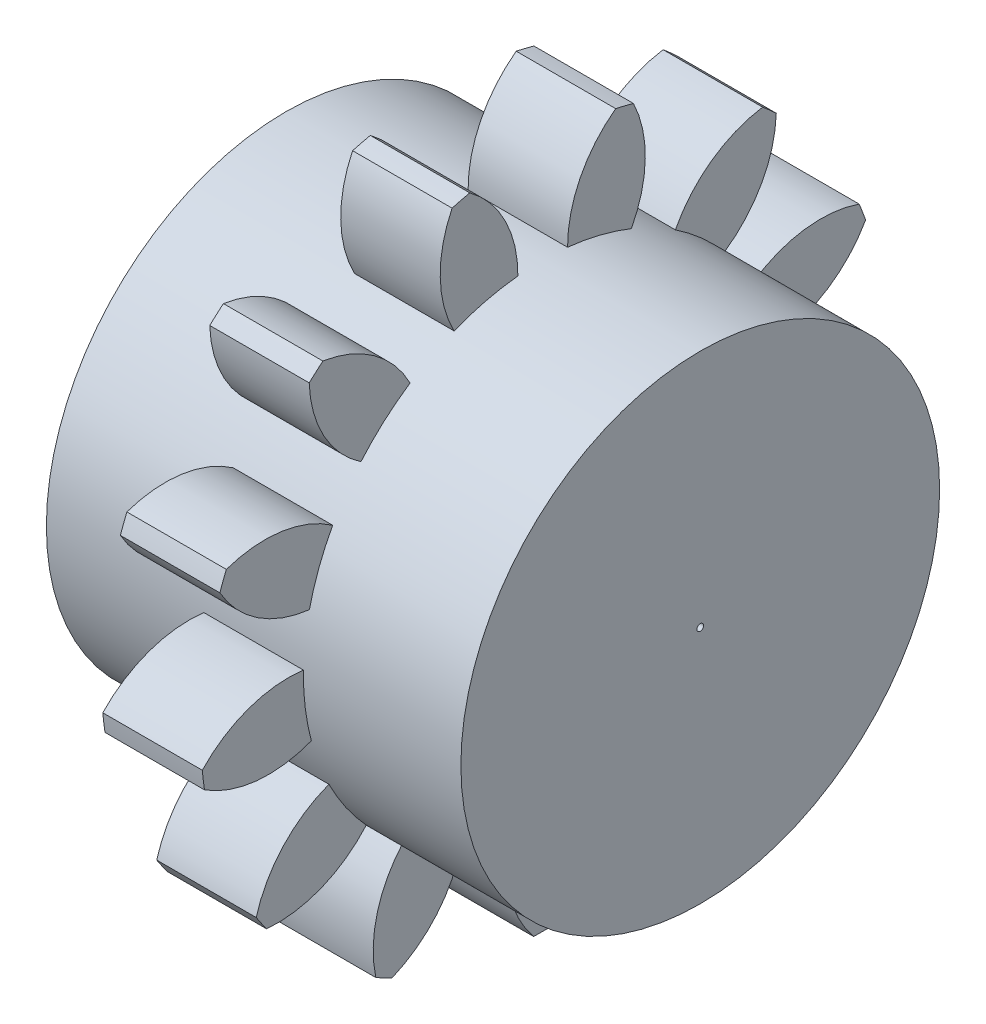
from build123d import *
from build123d.topology import SkipClean

# Parameters (mm, degrees)
BASPROSKE_W       = 12
BASPROSKE_H       = 41.25
TOOTHCUT_DEPTH    = 60.557745088
TEETHCUTS_COUNT   = 13
TEETHCUTS_ANGLE   = 332.307692308
HUBNEARBOTH_START = 19.0000254
HUBNEABOTSKE_R    = 28.874
HUBNEARBOTH_DEPTH = 19.0000254
HUBFARSKE_R       = 28.874
HUBFAR_DEPTH      = 19.0000254
BORSKE_R          = 0.4
BORE_DEPTH        = 50.0000508


with BuildPart() as part:
    # BasProSke → Base-Revolve (revolve)
    with BuildSketch(Plane(origin=(0, 0, 0), x_dir=(1, 0, 0), z_dir=(0, 1, 0)), mode=Mode.PRIVATE) as base_revolve_sk:
        with Locations((6, 20.625)):
            Rectangle(BASPROSKE_W, BASPROSKE_H)
    revolve(base_revolve_sk.sketch.rotate(Axis((-10, 0, 0), (1, 0, 0)), 180), axis=Axis((-10, 0, 0), (1, 0, 0)))

    # TooCutSke → ToothCut (cut, through all)
    with BuildSketch(Plane(origin=(0, 0, 0), x_dir=(0, 0, -1), z_dir=(1, 0, 0))):
        with BuildLine():
            ThreePointArc((2.996554373, 28.718087295), (0, 28.874), (-2.996554373, 28.718087295))
            ThreePointArc((-2.996554373, 28.718087295), (-4.518463565, 35.219204881), (-8.8260662, 40.320704366))
            ThreePointArc((-8.8260662, 40.320704366), (0, 41.2754), (8.8260662, 40.320704366))
            ThreePointArc((8.8260662, 40.320704366), (4.518463565, 35.219204881), (2.996554373, 28.718087295))
        make_face()
    toothcut = extrude(amount=TOOTHCUT_DEPTH, mode=Mode.SUBTRACT)

    # TeethCuts: ToothCut ×13 about axis
    teethcuts_axis = Axis((-10, 0, 0), (1, 0, 0))
    for i in range(1, TEETHCUTS_COUNT):
        add(toothcut.rotate(teethcuts_axis, i * TEETHCUTS_ANGLE / (TEETHCUTS_COUNT - 1)), mode=Mode.SUBTRACT)

    # HubNeaBotSke → HubNearBoth (add)
    with SkipClean():  # the faces are left unmerged after this step: merging them gives an invalid solid
        with BuildSketch(Plane.ZY.offset(HUBNEARBOTH_START)):
            Circle(HUBNEABOTSKE_R)
        extrude(amount=-HUBNEARBOTH_DEPTH)

    # HubFarSke → HubFar (add)
    with SkipClean():  # the faces are left unmerged after this step: merging them gives an invalid solid
        with BuildSketch(Plane(origin=(12, 0, 0), x_dir=(0, 0, -1), z_dir=(1, 0, 0))):
            with Locations(Location((0, 0, 0), (0, 0, 180))):
                Circle(HUBFARSKE_R)
        extrude(amount=HUBFAR_DEPTH)

    # BorSke → Bore (cut, symmetric)
    with SkipClean():  # the faces are left unmerged after this step: merging them gives an invalid solid
        with BuildSketch(Plane(origin=(0, 0, 0), x_dir=(0, 0, -1), z_dir=(1, 0, 0))):
            with Locations(Location((0, 0, 0), (0, 0, 180))):
                Circle(BORSKE_R)
        extrude(amount=BORE_DEPTH, both=True, mode=Mode.SUBTRACT)


solid = part.part
